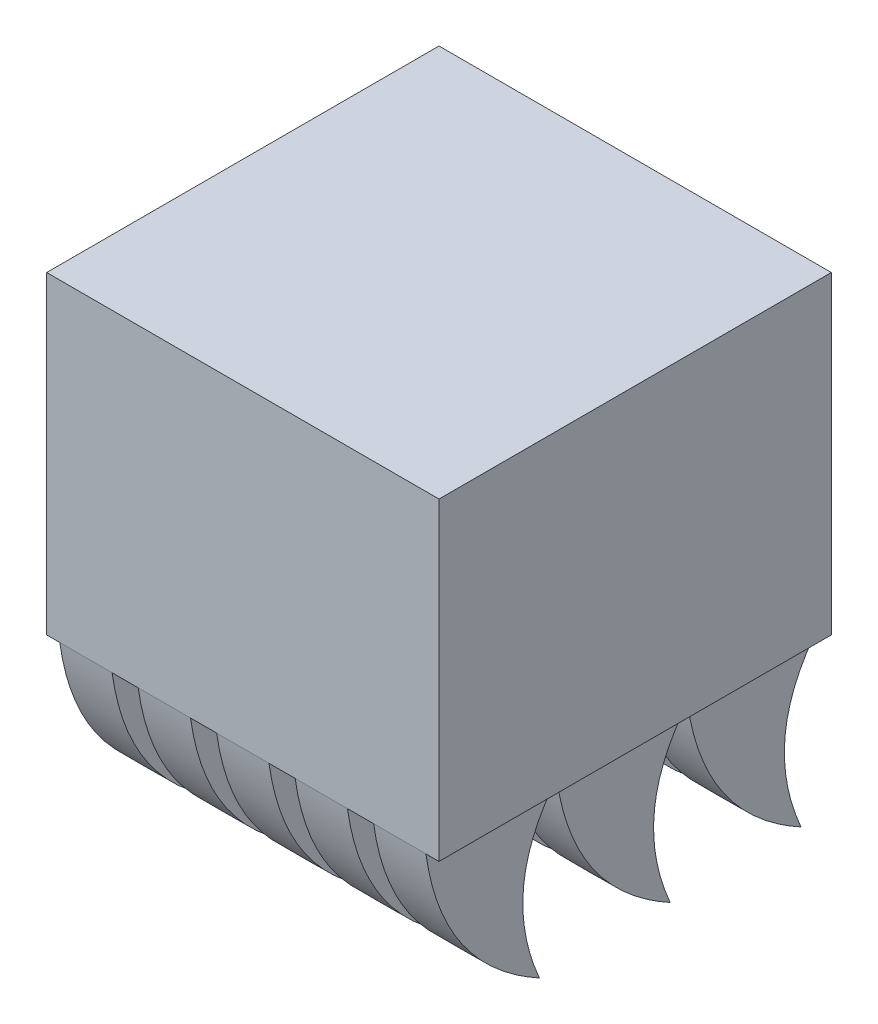
from build123d import *

# Parameters (mm, degrees)
SKETCH_1_W                  = 15
SKETCH_1_H                  = 15
EXTRUDE_1_DEPTH             = 6
EXTRUDE_2_DEPTH             = 1
PATTERN_LINEAR_1_COUNT      = 3
PATTERN_LINEAR_1_PITCH      = 3
PATTERN_LINEAR_1_COUNT_DIR2 = 3
PATTERN_LINEAR_1_PITCH_DIR2 = 5
PATTERN_LINEAR_2_COUNT      = 3
PATTERN_LINEAR_2_PITCH      = 3
PATTERN_LINEAR_2_COUNT_DIR2 = 3
PATTERN_LINEAR_2_PITCH_DIR2 = 5


with BuildPart() as part:
    # 스케치1 → 보스-돌출1 (new, symmetric)
    with BuildSketch(Plane(origin=(0, 0, 0), x_dir=(1, 0, 0), z_dir=(0, 1, 0))):
        Rectangle(SKETCH_1_W, SKETCH_1_H)
    extrude(amount=EXTRUDE_1_DEPTH, both=True)

    # 스케치3 → 보스-돌출2 (add, symmetric)
    with BuildSketch(Plane(origin=(0, 0, 0), x_dir=(0, 0, -1), z_dir=(1, 0, 0))):
        with BuildLine():
            Line((2.5, -6), (7.5, -6))
            add(Edge.make_bspline(
                [(6.837946582, -12.278081575), (5.299376428, -8.730527415), (7.5, -6)],
                knots=[0, 0, 0, 1, 1, 1], degree=2))
            add(Edge.make_bspline(
                [(2.5, -6), (3.098107293, -10.225865232), (6.837946582, -12.278081575)],
                knots=[0, 0, 0, 1, 1, 1], degree=2))
        make_face()
    extrude_2 = extrude(amount=EXTRUDE_2_DEPTH, both=True)

    # 선형 패턴1: Extrude 2 3 × 3
    with Locations(*[(-i * PATTERN_LINEAR_1_PITCH, 0, j * PATTERN_LINEAR_1_PITCH_DIR2) for i in range(PATTERN_LINEAR_1_COUNT) for j in range(PATTERN_LINEAR_1_COUNT_DIR2) if (i, j) != (0, 0)]):
        add(extrude_2)

    # 선형 패턴2: Extrude 2 3 × 3
    with Locations(*[(i * PATTERN_LINEAR_2_PITCH, 0, j * PATTERN_LINEAR_2_PITCH_DIR2) for i in range(PATTERN_LINEAR_2_COUNT) for j in range(PATTERN_LINEAR_2_COUNT_DIR2) if (i, j) != (0, 0)]):
        add(extrude_2)


solid = part.part
